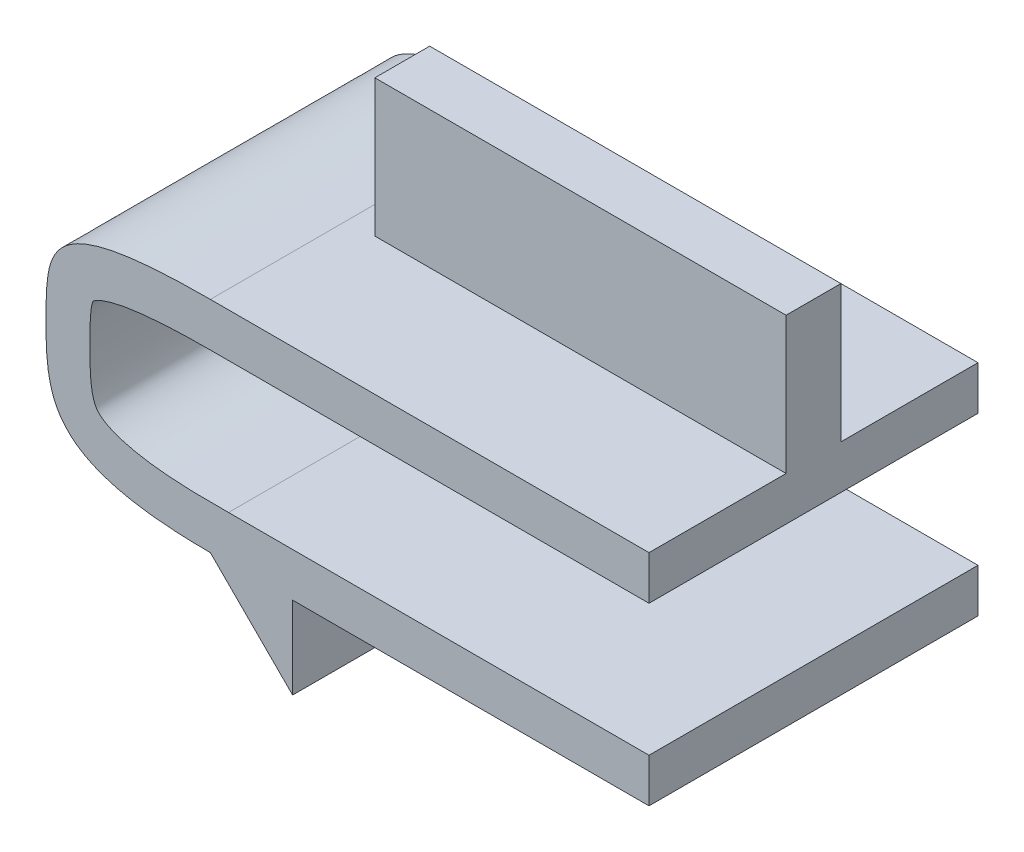
from build123d import *

# Parameters (mm, degrees)
BOSS_EXTRUDE1_DEPTH = 12
SKETCH4_W           = 15
SKETCH4_H           = 2
BOSS_EXTRUDE2_DEPTH = 5


with BuildPart() as part:
    # Sketch3 → Boss-Extrude1 (new body)
    with BuildSketch(Plane.XY.offset(61.271539715)):
        with BuildLine():
            Line((22, 49.150430771), (6, 49.150430771))
            add(Edge.make_bspline(
                [(6, 49.150430771), (0.397936137, 49.150430771), (0.000649692, 47.779287293), (-0.008454, 43.166439227), (0.529679054, 41.150430771), (6, 41.150430771)],
                knots=[0, 0, 0, 0, 0.444599043, 0.544599043, 1, 1, 1, 1], degree=3))
            Line((6, 41.150430771), (9, 38.150430771))
            Line((9, 38.150430771), (9, 41.150430771))
            Line((9, 41.150430771), (22, 41.150430771))
            Line((22, 41.150430771), (22, 42.750430771))
            Line((22, 42.750430771), (7.4, 42.750430771))
            Line((7.4, 42.750430771), (6.6627417, 42.750430771))
            add(Edge.make_bspline(
                [(6, 47.550430771), (5.814300885, 47.550430771), (5.432601297, 47.547671152), (4.751733662, 47.531432192), (3.995606566, 47.491771372), (3.252179793, 47.416153303), (2.467185464, 47.286178925), (1.86636449, 47.08344062), (1.710373783, 46.938448113), (1.726658165, 46.965738219), (1.616713293, 46.665186808), (1.588317561, 45.573387193), (1.619239413, 44.52789914), (1.694287589, 43.966857293), (1.813269122, 43.66756524), (1.934018721, 43.504771298), (2.279167095, 43.252557491), (2.976537313, 43.013614634), (3.819693321, 42.866898514), (4.599880812, 42.788084551), (5.376142657, 42.753233409), (6.079041938, 42.749870243), (6.471600888, 42.750430771), (6.6627417, 42.750430771)],
                knots=[0, 0, 0, 0, 0.015912359, 0.031824717, 0.063649434, 0.095474152, 0.127298869, 0.190948303, 0.254597738, 0.318247172, 0.381896606, 0.509195475, 0.57284491, 0.636494344, 0.700143778, 0.763793213, 0.827442647, 0.891092082, 0.922916799, 0.954741516, 0.986566233, 1.002478592, 1.01839095, 1.01839095, 1.01839095, 1.01839095], degree=3))
            Line((6, 47.550430771), (22, 47.550430771))
            Line((22, 47.550430771), (22, 49.150430771))
        make_face()
    extrude(amount=-BOSS_EXTRUDE1_DEPTH)

    # Sketch4 → Boss-Extrude2 (add)
    with BuildSketch(Plane(origin=(0, 49.150430771, 0), x_dir=(1, 0, 0), z_dir=(0, 1, 0))):
        with Locations((14.5, -55.271539715)):
            Rectangle(SKETCH4_W, SKETCH4_H)
    extrude(amount=BOSS_EXTRUDE2_DEPTH)


solid = part.part
